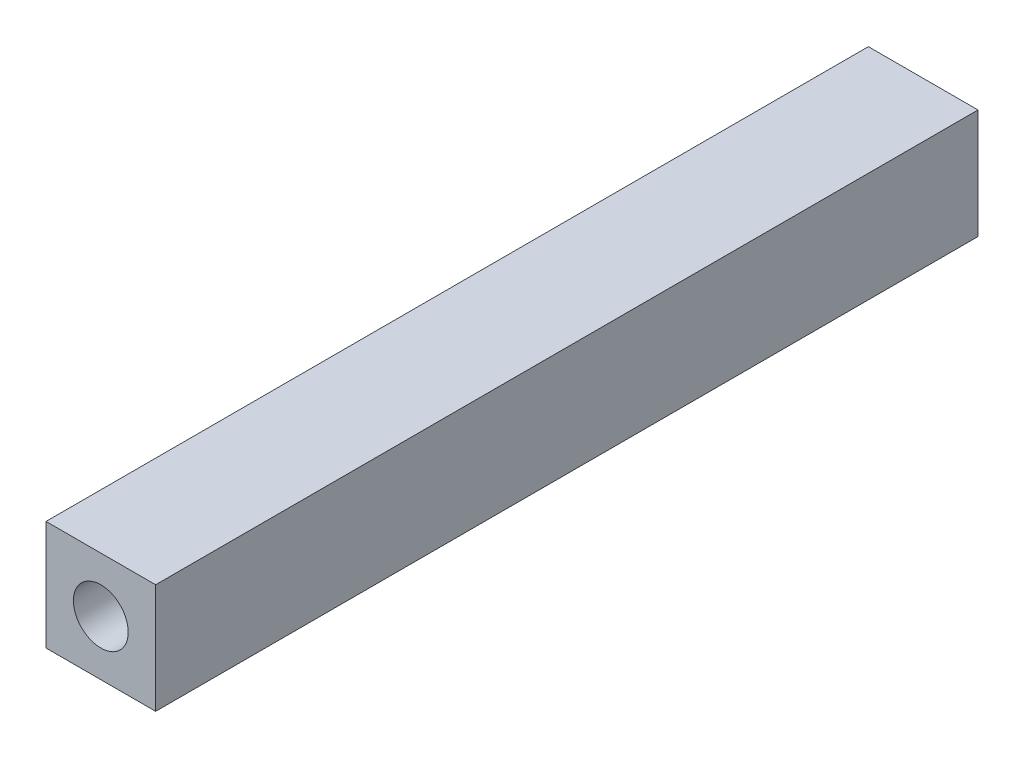
from build123d import *

# Parameters (mm, degrees)
SKETCH1_W           = 20
SKETCH1_H           = 20
SKETCH1_R           = 5
BOSS_EXTRUDE1_DEPTH = 150


with BuildPart() as part:
    # Sketch1 → Boss-Extrude1 (new body)
    with BuildSketch(Plane.XY):
        Rectangle(SKETCH1_W, SKETCH1_H)
        Circle(SKETCH1_R, mode=Mode.SUBTRACT)
    extrude(amount=BOSS_EXTRUDE1_DEPTH)


solid = part.part
